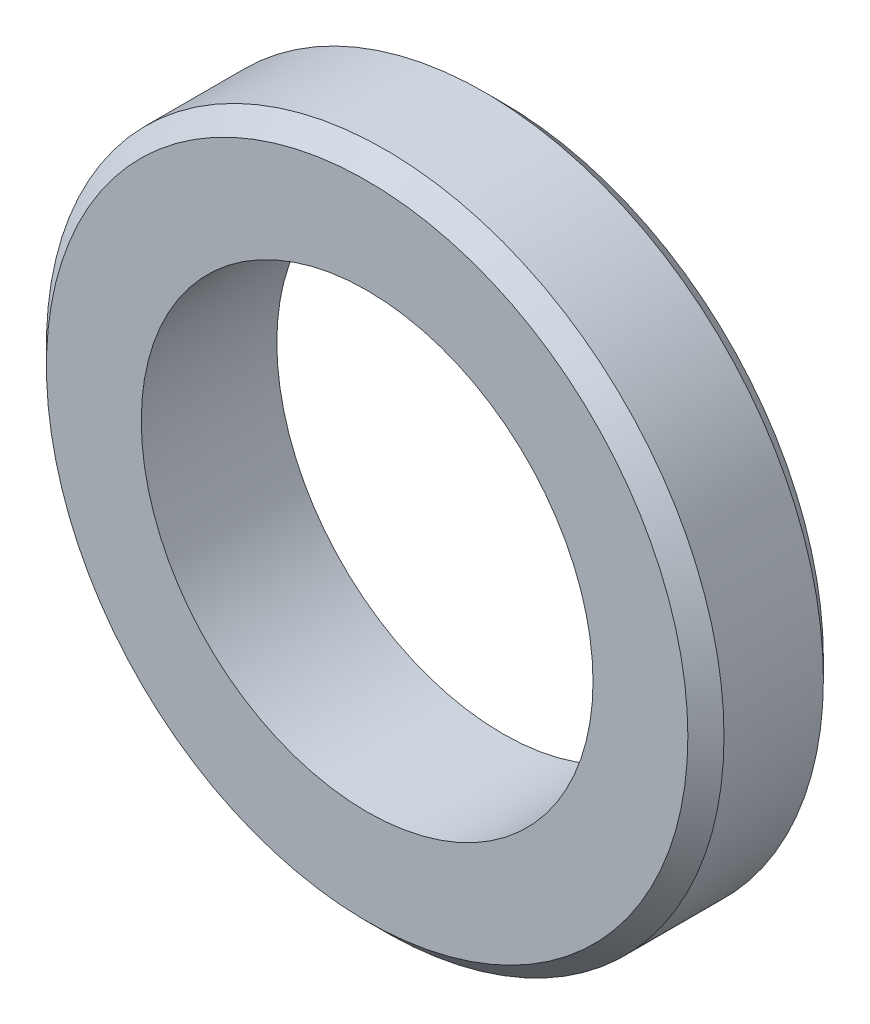
from build123d import *

# Parameters (mm, degrees)
SKETCH1_R           = 7.5
SKETCH1_R_2         = 5
BOSS_EXTRUDE1_DEPTH = 3
CHAMFER1_SIZE       = 0.4


with BuildPart() as part:
    # Sketch1 → Boss-Extrude1 (new body)
    with BuildSketch(Plane.XY):
        Circle(SKETCH1_R)
        Circle(SKETCH1_R_2, mode=Mode.SUBTRACT)
    extrude(amount=BOSS_EXTRUDE1_DEPTH)

    # Chamfer1
    chamfer1_edges = [part.edges().sort_by_distance(p)[0] for p in [
        (-7.5, 0, 0),
        (-7.5, 0, 3),
    ]]
    chamfer(chamfer1_edges, length=CHAMFER1_SIZE)


solid = part.part
